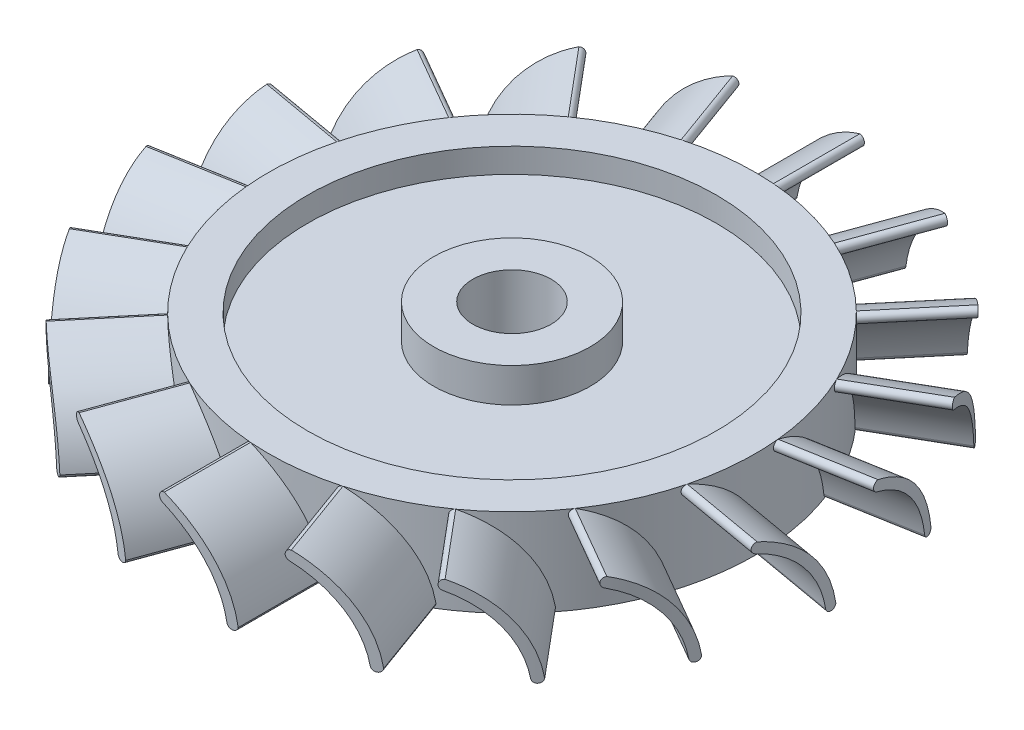
from build123d import *

# Parameters (mm, degrees)
Y_KSEKLIK_EKSTR_ZYON4_DEPTH = 10.4
DAIRESEL_KAPLAMA1_COUNT     = 18
IZIM3_W                     = 2
IZIM3_H                     = 32.099951844


with BuildPart() as part:
    # Çizim1 → Döndür1 (revolve)
    with BuildSketch(Plane.XY, mode=Mode.PRIVATE) as d_nd_r1_sk:
        Polygon((-24.9, -3.93325986), (-24.9, 5.06674014), (-20.9, 5.06674014), (-20.9, 2.56674014), (-8, 2.56674014), (-8, 6.06674014), (-4, 6.06674014), (-4, -3.93325986), (-8, -3.93325986), (-8, -1.43325986), (-20.9, -1.43325986), (-20.9, -3.93325986), align=None)
    revolve(d_nd_r1_sk.sketch.rotate(Axis((0, 0, 0), (0, 1, 0)), 270), axis=Axis((0, 0, 0), (0, 1, 0)))

    # Çizim2 → Yükseklik-Ekstrüzyon4 (add)
    with BuildSketch(Plane.XY.offset(24)):
        with BuildLine():
            ThreePointArc((5.288121592, -3.506719129), (2.925669203, 1.819912752), (-1.912956677, 5.06674014))
            ThreePointArc((-1.912956677, 5.06674014), (-2.416738613, 4.651992765), (-2.106468148, 4.077933654))
            ThreePointArc((-2.106468148, 4.077933654), (2.153477976, 1.184433162), (4.277760504, -3.506719129))
            ThreePointArc((4.277760504, -3.506719129), (4.782941048, -3.93325986), (5.288121592, -3.506719129))
        make_face()
    y_kseklik_ekstr_zyon4 = extrude(amount=Y_KSEKLIK_EKSTR_ZYON4_DEPTH)

    # Dairesel Kaplama1: Yükseklik-Ekstrüzyon4 ×18 about axis
    dairesel_kaplama1_axis = Axis((0, 0, 0), (0, 1, 0))
    for i in range(1, DAIRESEL_KAPLAMA1_COUNT):
        add(y_kseklik_ekstr_zyon4.rotate(dairesel_kaplama1_axis, i * 360 / DAIRESEL_KAPLAMA1_COUNT))

    # Çizim3 → Kes-Döndür1 (revolve, cut)
    with BuildSketch(Plane.XY):
        with Locations((34.7, 3.634736288)):
            Rectangle(IZIM3_W, IZIM3_H)
    revolve(axis=Axis((0, 18.900046721, 0), (0, -1, 0)), mode=Mode.SUBTRACT)


solid = part.part
